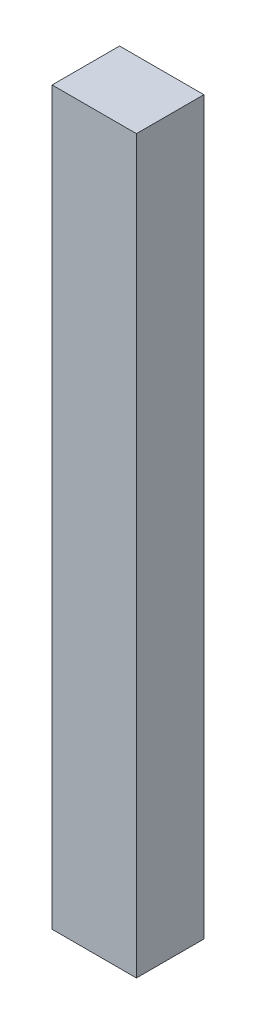
from build123d import *

# Parameters (mm, degrees)
ESQUISSE1_W        = 50
ESQUISSE1_H        = 433.57044328
BOSS_EXTRU_1_DEPTH = 40


with BuildPart() as part:
    # Esquisse1 → Boss.-Extru.1 (new body)
    with BuildSketch(Plane.XY):
        with Locations((-243.431690787, -603.21477836)):
            Rectangle(ESQUISSE1_W, ESQUISSE1_H)
    extrude(amount=BOSS_EXTRU_1_DEPTH)


solid = part.part
